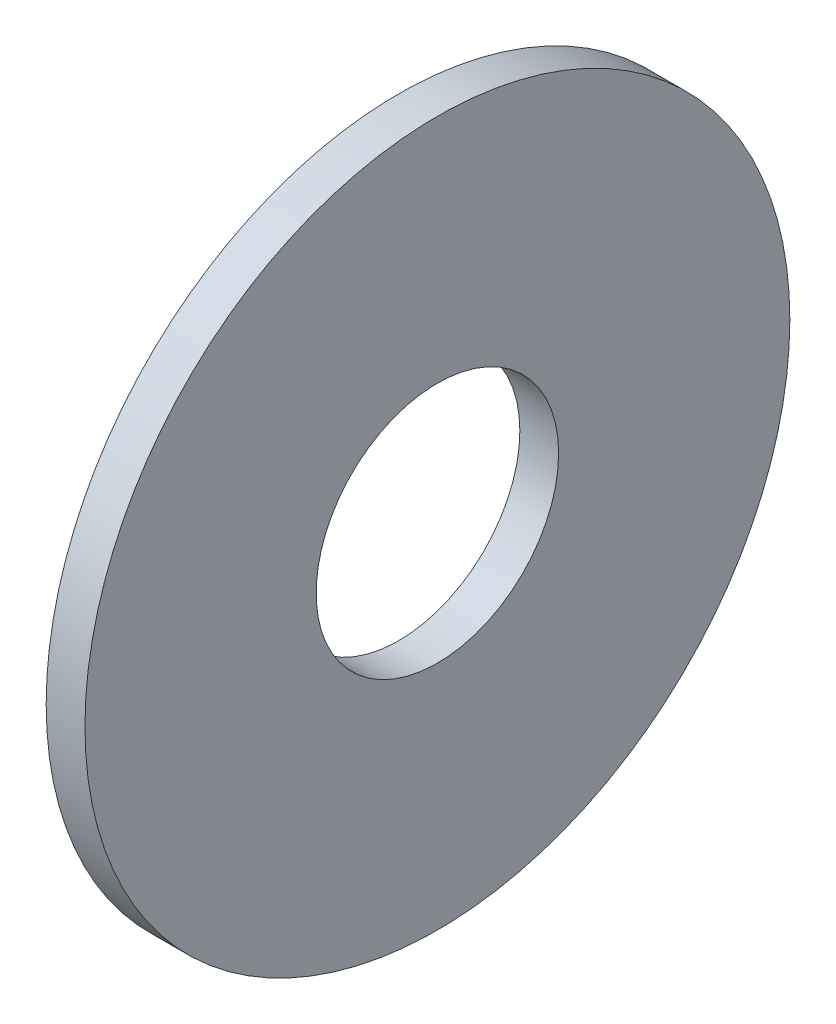
from build123d import *

# Parameters (mm, degrees)
SKETCH1_R           = 12.7
SKETCH1_R_2         = 4.3688
BOSS_EXTRUDE1_DEPTH = 1.397


with BuildPart() as part:
    # Sketch1 → Boss-Extrude1 (new body)
    with BuildSketch(Plane(origin=(0, 0, 0), x_dir=(0, 0, -1), z_dir=(1, 0, 0))):
        Circle(SKETCH1_R)
        Circle(SKETCH1_R_2, mode=Mode.SUBTRACT)
    extrude(amount=BOSS_EXTRUDE1_DEPTH)


solid = part.part
